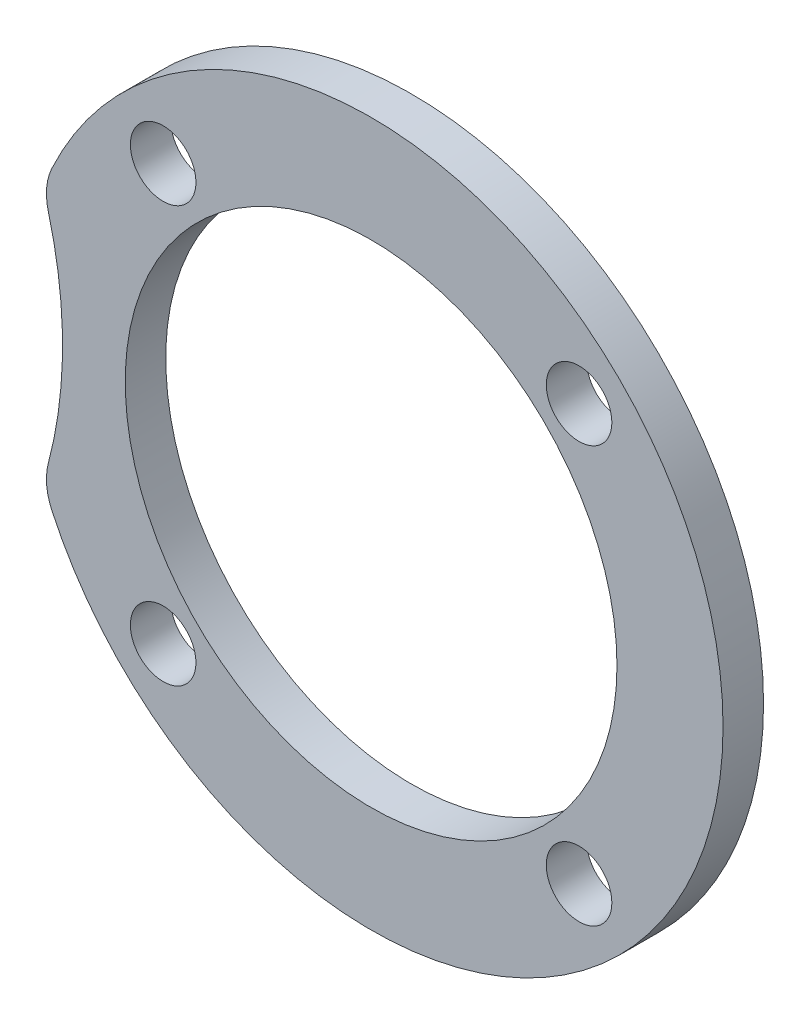
from build123d import *

# Parameters (mm, degrees)
SKETCH_1_R          = 18.25
SKETCH_1_R_2        = 12.75
EXTRUDE_1_DEPTH     = 1.05
SKETCH_2_R          = 22
CUT_EXTRUDE_1_DEPTH = 21.05
SKETCH_3_R          = 1.7
CUT_EXTRUDE_2_DEPTH = 16.05
FILLET_1_R          = 3


with BuildPart() as part:
    # 草图1 → 凸台-拉伸1 (new, symmetric)
    with BuildSketch(Plane.XY):
        Circle(SKETCH_1_R)
        Circle(SKETCH_1_R_2, mode=Mode.SUBTRACT)
    extrude(amount=EXTRUDE_1_DEPTH, both=True)

    # 草图2 → 切除-拉伸1 (cut, symmetric)
    with BuildSketch(Plane.XY.offset(1.05)):
        with Locations((-38, 0)):
            Circle(SKETCH_2_R)
    extrude(amount=CUT_EXTRUDE_1_DEPTH, both=True, mode=Mode.SUBTRACT)

    # 草图3 → 切除-拉伸2 (cut, symmetric)
    with BuildSketch(Plane.XY.offset(1.05)):
        with Locations((10.783378413, 10.783378413)):
            Circle(SKETCH_3_R)
        with Locations((10.783378413, -10.783378413)):
            Circle(SKETCH_3_R)
        with Locations((-10.783378413, -10.783378413)):
            Circle(SKETCH_3_R)
        with Locations((-10.783378413, 10.783378413)):
            Circle(SKETCH_3_R)
    extrude(amount=CUT_EXTRUDE_2_DEPTH, both=True, mode=Mode.SUBTRACT)

    # 圆角1
    fillet_1_edges = [part.edges().sort_by_distance(p)[0] for p in [
        (-17.013980263, -6.60204329, 0),
        (-17.013980263, 6.60204329, 0),
    ]]
    fillet(fillet_1_edges, radius=FILLET_1_R)


solid = part.part
